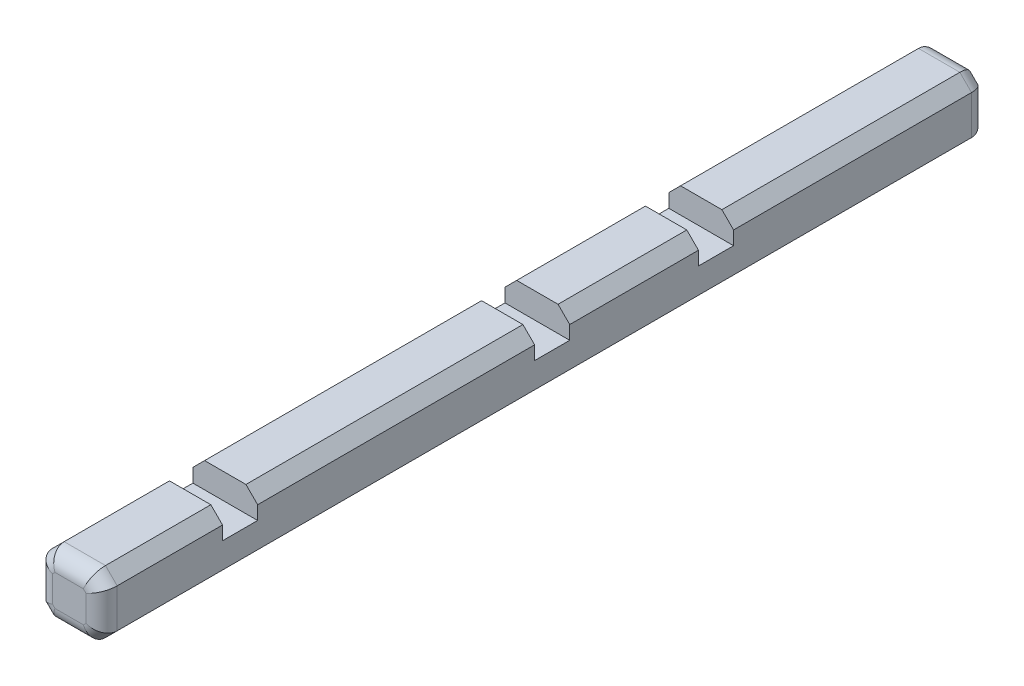
from build123d import *

# Parameters (mm, degrees)
SKETCH1_W           = 8.3
SKETCH1_H           = 8
BOSS_EXTRUDE1_DEPTH = 113.5
CHAMFER2_SIZE       = 1.5
SKETCH3_W           = 8.3
SKETCH3_H           = 3.25
CUT_EXTRUDE1_DEPTH  = 4.5
SKETCH4_W           = 8.3
SKETCH4_H           = 3.25
CUT_EXTRUDE2_DEPTH  = 4.5
FILLET1_R           = 2
SKETCH6_W           = 8.3
SKETCH6_H           = 3.25
CUT_EXTRUDE3_DEPTH  = 4.5


with BuildPart() as part:
    # Sketch1 → Boss-Extrude1 (new body)
    with BuildSketch(Plane.XY):
        Rectangle(SKETCH1_W, SKETCH1_H)
    extrude(amount=BOSS_EXTRUDE1_DEPTH)

    # Chamfer2
    chamfer2_edges = [part.edges().sort_by_distance(p)[0] for p in [
        (-4.15, 4, 56.75),
        (4.15, 4, 56.75),
        (4.15, -4, 56.75),
        (-4.15, -4, 56.75),
    ]]
    chamfer(chamfer2_edges, length=CHAMFER2_SIZE)

    # Sketch3 → Cut-Extrude1 (cut)
    with BuildSketch(Plane(origin=(0, 0, 58), x_dir=(-1, 0, 0), z_dir=(0, 0, -1))):
        with Locations((0, 2.375)):
            Rectangle(SKETCH3_W, SKETCH3_H)
    extrude(amount=CUT_EXTRUDE1_DEPTH, mode=Mode.SUBTRACT)

    # Sketch4 → Cut-Extrude2 (cut)
    with BuildSketch(Plane(origin=(0, 0, 98), x_dir=(-1, 0, 0), z_dir=(0, 0, -1))):
        with Locations((0, 2.375)):
            Rectangle(SKETCH4_W, SKETCH4_H)
    extrude(amount=CUT_EXTRUDE2_DEPTH, mode=Mode.SUBTRACT)

    # Fillet1
    fillet1_edges = [part.edges().sort_by_distance(p)[0] for p in [
        (4.15, 0, 0),
        (4.15, 0, 113.5),
        (-4.15, 0, 0),
        (0, 4, 0),
        (0, -4, 0),
        (-3.4, 3.25, 0),
        (3.4, 3.25, 0),
        (-3.4, -3.25, 0),
        (3.4, -3.25, 0),
        (0, -4, 113.5),
        (-4.15, 0, 113.5),
        (0, 4, 113.5),
        (-3.4, 3.25, 113.5),
        (3.4, 3.25, 113.5),
        (-3.4, -3.25, 113.5),
        (3.4, -3.25, 113.5),
    ]]
    fillet(fillet1_edges, radius=FILLET1_R)

    # Sketch6 → Cut-Extrude3 (cut)
    with BuildSketch(Plane(origin=(0, 0, 37), x_dir=(-1, 0, 0), z_dir=(0, 0, -1))):
        with Locations((0, 2.375)):
            Rectangle(SKETCH6_W, SKETCH6_H)
    extrude(amount=CUT_EXTRUDE3_DEPTH, mode=Mode.SUBTRACT)


solid = part.part
